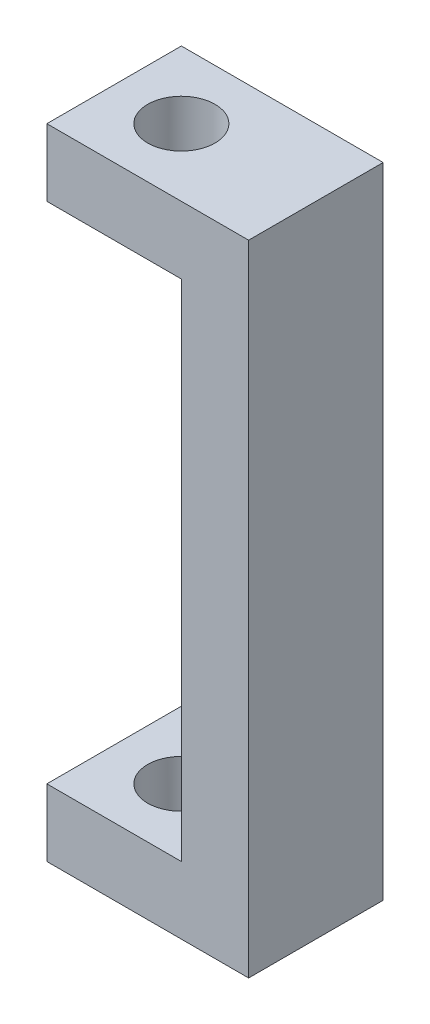
from build123d import *

# Parameters (mm, degrees)
BOSS_EXTRUDE1_DEPTH = 8
SKETCH2_R           = 2
CUT_EXTRUDE1_DEPTH  = 38


with BuildPart() as part:
    # Sketch1 → Boss-Extrude1 (new body)
    with BuildSketch(Plane.XY):
        Polygon((0, 0), (12, 0), (12, -38), (0, -38), (0, -34), (8, -34), (8, -4), (0, -4), align=None)
    extrude(amount=BOSS_EXTRUDE1_DEPTH)

    # Sketch2 → Cut-Extrude1 (cut)
    with BuildSketch(Plane(origin=(0, 0, 0), x_dir=(1, 0, 0), z_dir=(0, 1, 0))):
        with Locations(Location((4, -4, 0), (0, 0, 270))):
            Circle(SKETCH2_R)
    extrude(amount=-CUT_EXTRUDE1_DEPTH, mode=Mode.SUBTRACT)


solid = part.part
